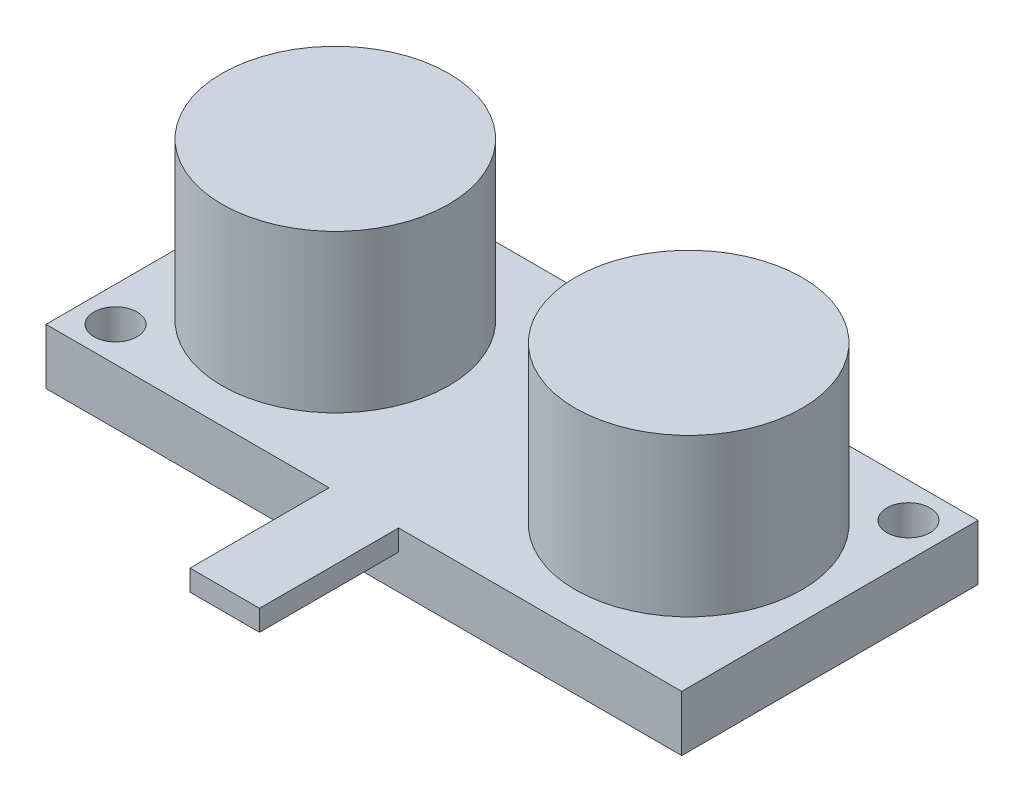
from build123d import *

# Parameters (mm, degrees)
SKETCH1_W           = 45.7
SKETCH1_H           = 21.3
SKETCH1_R           = 1.55
BOSS_EXTRUDE1_DEPTH = 4
SKETCH2_R           = 8.15
BOSS_EXTRUDE2_DEPTH = 11.3
SKETCH3_W           = 5
SKETCH3_H           = 1.5
BOSS_EXTRUDE3_DEPTH = 10


with BuildPart() as part:
    # Sketch1 → Boss-Extrude1 (new body)
    with BuildSketch(Plane(origin=(0, 0, 0), x_dir=(1, 0, 0), z_dir=(0, 1, 0))):
        with Locations((22.85, 10.65)):
            Rectangle(SKETCH1_W, SKETCH1_H)
        with Locations(Location((43.2, 18.8, 0), (0, 0, 270))):
            Circle(SKETCH1_R, mode=Mode.SUBTRACT)
        with Locations(Location((2.5, 2.5, 0), (0, 0, 270))):
            Circle(SKETCH1_R, mode=Mode.SUBTRACT)
    extrude(amount=BOSS_EXTRUDE1_DEPTH)

    # Sketch2 → Boss-Extrude2 (add)
    with BuildSketch(Plane(origin=(0, 4, 0), x_dir=(-1, 0, 0), z_dir=(0, 1, 0))):
        with Locations(Location((-35.55, -10.65, 0), (0, 0, 270))):
            Circle(SKETCH2_R)
        with Locations(Location((-10.15, -10.65, 0), (0, 0, 270))):
            Circle(SKETCH2_R)
    extrude(amount=BOSS_EXTRUDE2_DEPTH)

    # Sketch3 → Boss-Extrude3 (add)
    with BuildSketch(Plane.XY):
        with Locations((22.85, 3.25)):
            Rectangle(SKETCH3_W, SKETCH3_H)
    extrude(amount=BOSS_EXTRUDE3_DEPTH)


solid = part.part
